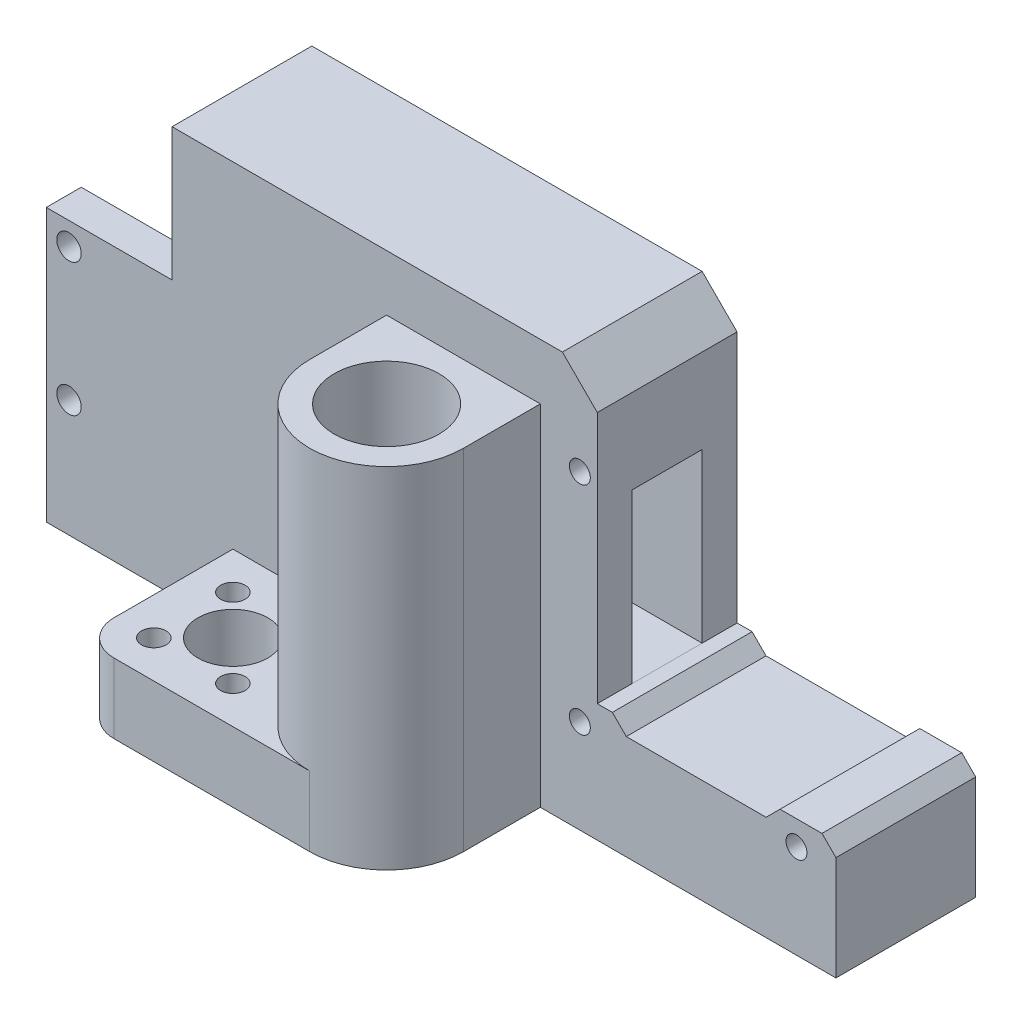
from build123d import *

# Parameters (mm, degrees)
EXTRUDE_1_DEPTH     = 20
SKETCH_2_R          = 1.5
CUT_EXTRUDE_1_DEPTH = 20
SKETCH_3_R          = 7.5
EXTRUDE_2_DEPTH     = 50
EXTRUDE_3_DEPTH     = 10
SKETCH_7_W          = 18
SKETCH_7_H          = 39
EXTRUDE_4_DEPTH     = 5
SKETCH_9_R          = 5
SKETCH_9_R_2        = 1.75
CUT_EXTRUDE_2_DEPTH = 15
SKETCH_12_R         = 4
CUT_EXTRUDE_3_DEPTH = 20
CUT_EXTRUDE_START   = -60.849857
SKETCH_13_W         = 10
SKETCH_13_H         = 24
CUT_EXTRUDE_4_DEPTH = 60.849857
SKETCH_14_R         = 1.75
CUT_EXTRUDE_5_DEPTH = 10


with BuildPart() as part:
    # 草图1 → 凸台-拉伸1 (new body)
    with BuildSketch(Plane.XY):
        Polygon((-18, 29.079835166), (-13.000041786, 24.079835166), (-13.000343311, -12.000164834), (-10.85, -12.000164834), (-8.85, -14.000164834), (11.15, -14.000164834), (13.15, -12.000164834), (19.15, -12.000164834), (21.15, -14.000164834), (21.15, -28.920164834), (-73.85, -28.920164834), (-73.85, 29.079835166), align=None)
    extrude(amount=EXTRUDE_1_DEPTH)

    # 草图2 → 切除-拉伸1 (cut)
    with BuildSketch(Plane.XY.offset(20)):
        with Locations((-15.5, 15.5)):
            Circle(SKETCH_2_R)
        with Locations((-15.5, -15.5)):
            Circle(SKETCH_2_R)
        with Locations((15.5, -15.5)):
            Circle(SKETCH_2_R)
    extrude(amount=-CUT_EXTRUDE_1_DEPTH, mode=Mode.SUBTRACT)

    # 草图3 → 凸台-拉伸2 (add)
    with BuildSketch(Plane.XZ.offset(28.920164834)):
        with BuildLine():
            Line((-43.15, 31), (-43.15, 20))
            Line((-43.15, 20), (-21.15, 20))
            Line((-21.15, 20), (-21.15, 31))
            ThreePointArc((-21.15, 31), (-32.15, 42), (-43.15, 31))
        make_face()
        with Locations((-32.15, 31)):
            Circle(SKETCH_3_R, mode=Mode.SUBTRACT)
    extrude(amount=-EXTRUDE_2_DEPTH)

    # 草图5 → 凸台-拉伸3 (add)
    with BuildSketch(Plane.XZ.offset(28.920164834)):
        with BuildLine():
            Line((-43.15, 42), (-32.15, 42))
            ThreePointArc((-32.15, 42), (-39.928174593, 38.778174593), (-43.15, 31))
            Line((-43.15, 31), (-43.15, 20))
            Line((-43.15, 20), (-65.15, 20))
            Line((-65.15, 20), (-65.15, 37))
            ThreePointArc((-65.15, 37), (-63.685533906, 40.535533906), (-60.15, 42))
            Line((-60.15, 42), (-43.15, 42))
        make_face()
    extrude(amount=-EXTRUDE_3_DEPTH)

    # 草图7 → 凸台-拉伸4 (add)
    with BuildSketch(Plane.XY.offset(20)):
        with Locations((-82.85, -9.420164834)):
            Rectangle(SKETCH_7_W, SKETCH_7_H)
    extrude(amount=-EXTRUDE_4_DEPTH)

    # 草图9 → 切除-拉伸2 (cut)
    with BuildSketch(Plane.XZ.offset(28.920164834)):
        with Locations((-54.15, 31)):
            Circle(SKETCH_9_R)
        with Locations((-59.806854249, 36.656854249)):
            Circle(SKETCH_9_R_2)
        with Locations((-48.493145751, 36.656854249)):
            Circle(SKETCH_9_R_2)
        with Locations((-48.493145751, 25.343145751)):
            Circle(SKETCH_9_R_2)
        with Locations((-59.806854249, 25.343145751)):
            Circle(SKETCH_9_R_2)
    extrude(amount=-CUT_EXTRUDE_2_DEPTH, mode=Mode.SUBTRACT)

    # 草图12 → 切除-拉伸3 (cut)
    with BuildSketch(Plane.ZY.offset(73.85)):
        with Locations((10, 22.579835166)):
            Circle(SKETCH_12_R)
        with Locations((10, -22.420164834)):
            Circle(SKETCH_12_R)
    extrude(amount=-CUT_EXTRUDE_3_DEPTH, mode=Mode.SUBTRACT)

    # 草图13 → 切除-拉伸4 (cut)
    with BuildSketch(Plane.ZY.offset(73.85).offset(CUT_EXTRUDE_START)):
        with Locations((10, 0)):
            Rectangle(SKETCH_13_W, SKETCH_13_H)
    extrude(amount=CUT_EXTRUDE_4_DEPTH, mode=Mode.SUBTRACT)

    # 草图14 → 切除-拉伸5 (cut)
    with BuildSketch(Plane.XY.offset(20)):
        with Locations((-88.6, -12.170164834)):
            Circle(SKETCH_14_R)
        with Locations((-88.6, 6.829835166)):
            Circle(SKETCH_14_R)
    extrude(amount=-CUT_EXTRUDE_5_DEPTH, mode=Mode.SUBTRACT)


solid = part.part
